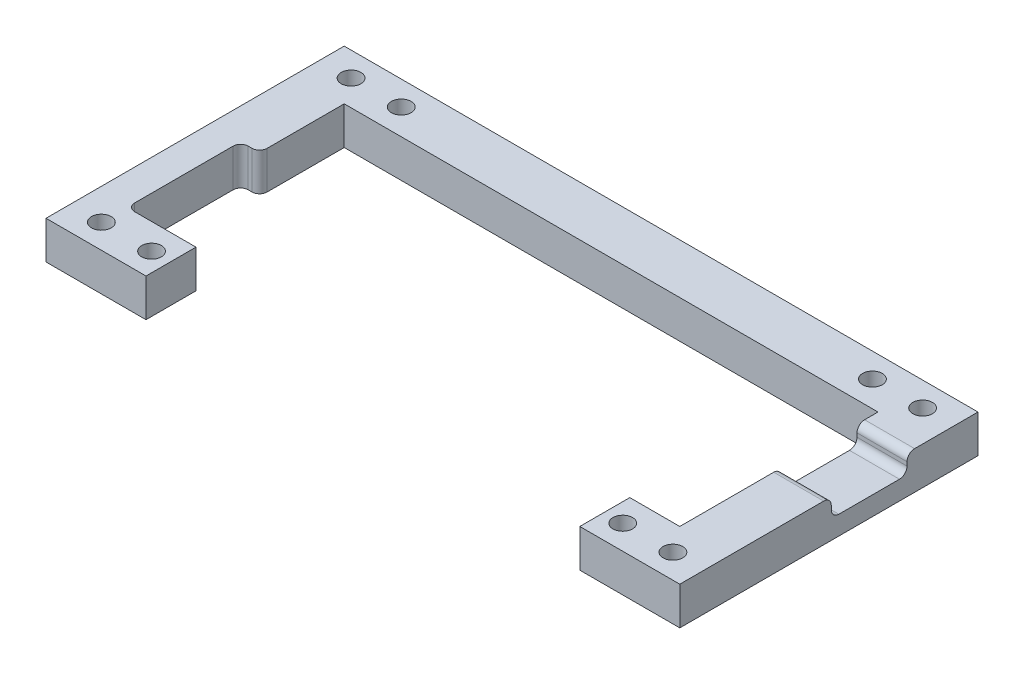
from build123d import *

# Parameters (mm, degrees)
SKETCH1_R           = 1.651
BOSS_EXTRUDE1_DEPTH = 6.35
SKETCH2_W           = 12.7
SKETCH2_H           = 3.175
CUT_EXTRUDE7_DEPTH  = 8.89
FILLET2_R           = 1.27
SKETCH4_W           = 3.175
SKETCH4_H           = 19.05
CUT_EXTRUDE8_DEPTH  = 192.82600491
FILLET3_R           = 1.27


with BuildPart() as part:
    # Sketch1 → Boss-Extrude1 (new body)
    with BuildSketch(Plane(origin=(0, 0, 0), x_dir=(1, 0, 0), z_dir=(0, 1, 0))):
        Polygon((75.155177047, 61.997896552), (75.155177047, 11.997896552), (91.919177047, 11.997896552), (91.919177047, 20.379896552), (83.537177047, 20.379896552), (83.537177047, 53.615896552), (173.037829354, 53.615896552), (173.037829354, 20.379896552), (164.655829354, 20.379896552), (164.655829354, 11.997896552), (181.419829354, 11.997896552), (181.419829354, 61.997896552), align=None)
        with Locations((80.3721812, 16.064784874)):
            Circle(SKETCH1_R, mode=Mode.SUBTRACT)
        with Locations((80.3721812, 57.93100823)):
            Circle(SKETCH1_R, mode=Mode.SUBTRACT)
        with Locations((167.7875512, 57.93100823)):
            Circle(SKETCH1_R, mode=Mode.SUBTRACT)
        with Locations((88.7874552, 57.93100823)):
            Circle(SKETCH1_R, mode=Mode.SUBTRACT)
        with Locations((88.7874552, 16.064784874)):
            Circle(SKETCH1_R, mode=Mode.SUBTRACT)
        with Locations((176.2028252, 57.93100823)):
            Circle(SKETCH1_R, mode=Mode.SUBTRACT)
        with Locations((176.2028252, 16.064784874)):
            Circle(SKETCH1_R, mode=Mode.SUBTRACT)
        with Locations((167.7875512, 16.064784874)):
            Circle(SKETCH1_R, mode=Mode.SUBTRACT)
    extrude(amount=BOSS_EXTRUDE1_DEPTH)

    # Sketch2 → Cut-Extrude7 (cut)
    with BuildSketch(Plane(origin=(181.419829354, 0, 0), x_dir=(0, 0, -1), z_dir=(1, 0, 0))):
        with Locations((43.747896552, 4.7625)):
            Rectangle(SKETCH2_W, SKETCH2_H)
    extrude(amount=-CUT_EXTRUDE7_DEPTH, mode=Mode.SUBTRACT)

    # Fillet2
    fillet2_edges = [part.edges().sort_by_distance(p)[0] for p in [
        (177.228829354, 3.175, -37.397896552),
        (177.228829354, 6.35, -37.397896552),
        (177.228829354, 6.35, -50.097896552),
        (177.228829354, 3.175, -50.097896552),
    ]]
    fillet(fillet2_edges, radius=FILLET2_R)

    # Sketch4 → Cut-Extrude8 (cut, through all)
    with BuildSketch(Plane(origin=(0, 6.35, 0), x_dir=(1, 0, 0), z_dir=(0, 1, 0))):
        with Locations((81.949677047, 29.904896552)):
            Rectangle(SKETCH4_W, SKETCH4_H)
    extrude(amount=-CUT_EXTRUDE8_DEPTH, mode=Mode.SUBTRACT)

    # Fillet3
    fillet3_edges = [part.edges().sort_by_distance(p)[0] for p in [
        (80.362177047, 3.175, -20.379896552),
        (80.362177047, 3.175, -39.429896552),
        (83.537177047, 3.175, -39.429896552),
    ]]
    fillet(fillet3_edges, radius=FILLET3_R)


solid = part.part
